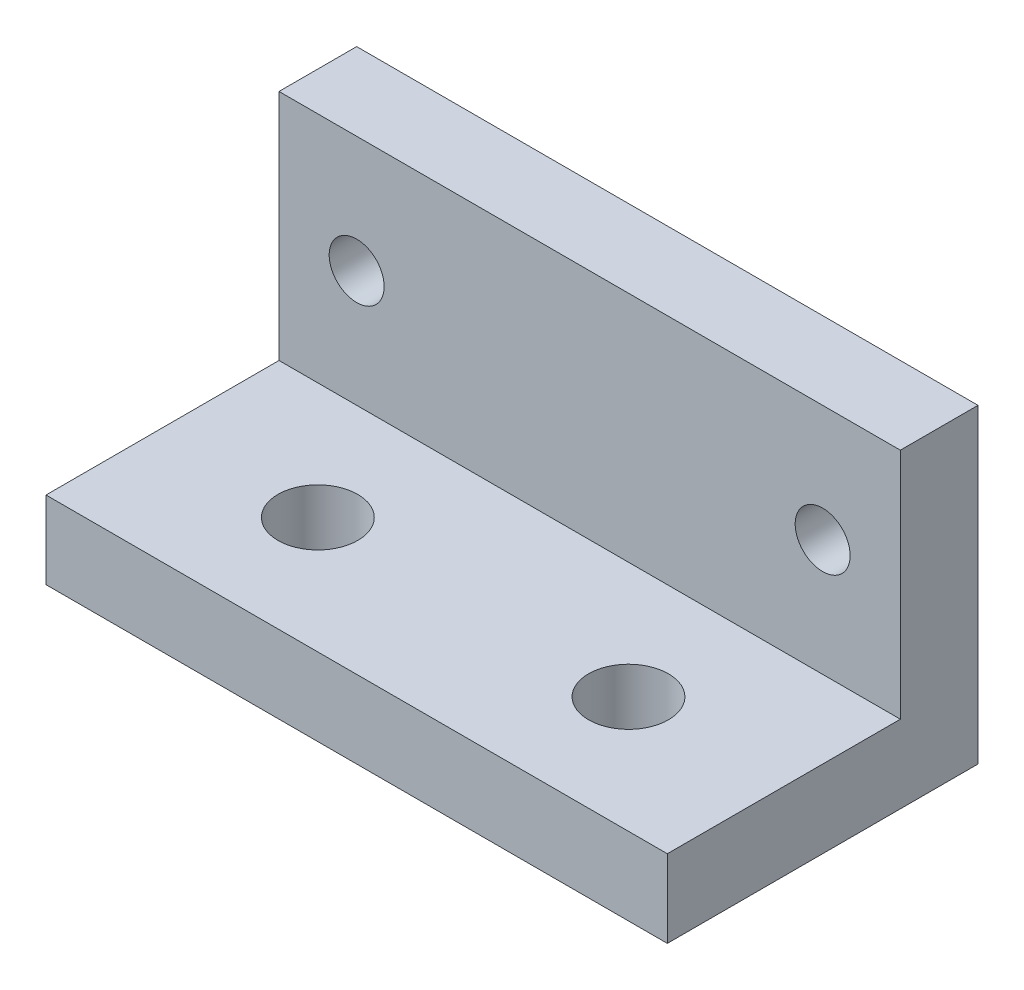
from build123d import *

# Parameters (mm, degrees)
BOSS_EXTRUDE1_DEPTH       = 25.4
F_1_4_CLEARANCE_HOLE1_D   = 6.5278
F_8_CLEARANCE_HOLE1_D     = 4.4958
F_8_CLEARANCE_HOLE1_DEPTH = 6.35
F_8_CLEARANCE_HOLE1_TIP   = 1.350674586


with BuildPart() as part:
    # Sketch1 → Boss-Extrude1 (new, symmetric)
    with BuildSketch(Plane(origin=(0, 0, 0), x_dir=(0, 0, -1), z_dir=(1, 0, 0))):
        Polygon((0, 0), (0, 25.4), (-6.35, 25.4), (-6.35, 6.35), (-25.4, 6.35), (-25.4, 0), align=None)
    extrude(amount=BOSS_EXTRUDE1_DEPTH, both=True)

    # 1/4 Clearance Hole1 (through all)
    with Locations(Plane(origin=(0, 6.35, 0), x_dir=(1, 0, 0), z_dir=(0, 1, 0))):
        with Locations((-12.7, -15.875), (12.7, -15.875)):
            Hole(F_1_4_CLEARANCE_HOLE1_D / 2)

    # #8 Clearance Hole1
    with Locations(Plane.XY.offset(6.35)):
        with Locations((-19.05, 15.875), (19.05, 15.875)):
            Hole(F_8_CLEARANCE_HOLE1_D / 2, depth=F_8_CLEARANCE_HOLE1_DEPTH)
            with Locations((0, 0, -(F_8_CLEARANCE_HOLE1_DEPTH + F_8_CLEARANCE_HOLE1_TIP / 2))):  # 118° drill point
                Cone(0, F_8_CLEARANCE_HOLE1_D / 2, F_8_CLEARANCE_HOLE1_TIP, mode=Mode.SUBTRACT)


solid = part.part
